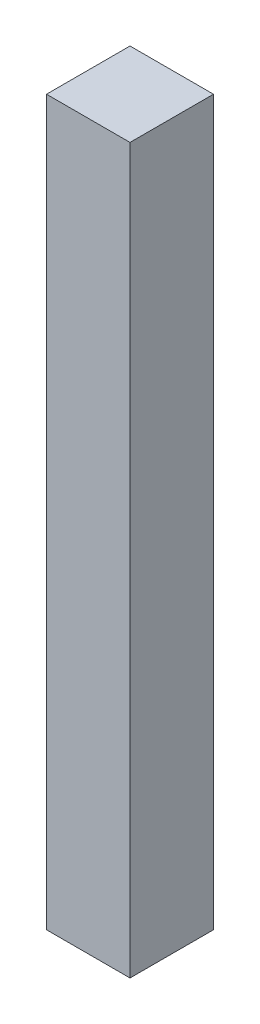
from build123d import *

# Parameters (mm, degrees)
SKETCH1_W           = 30
SKETCH1_H           = 30
BOSS_EXTRUDE1_DEPTH = 260


with BuildPart() as part:
    # Sketch1 → Boss-Extrude1 (new body)
    with BuildSketch(Plane(origin=(0, 0, 0), x_dir=(1, 0, 0), z_dir=(0, 1, 0))):
        with Locations((-25.048192771, -9.63253012)):
            Rectangle(SKETCH1_W, SKETCH1_H)
    extrude(amount=BOSS_EXTRUDE1_DEPTH)


solid = part.part
